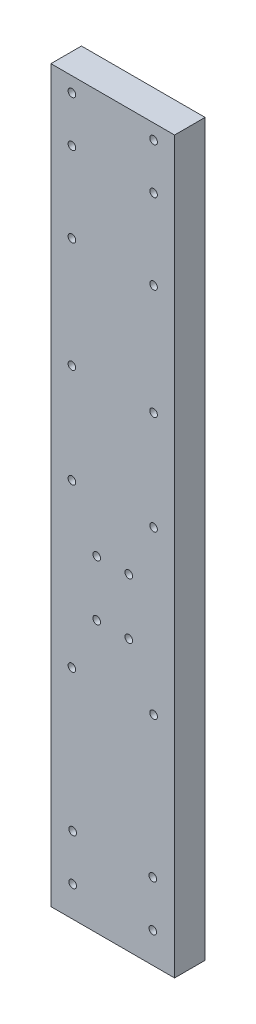
from build123d import *

# Parameters (mm, degrees)
SKETCH3_W           = 16.2
SKETCH3_H           = 95.66
SKETCH3_R           = 0.5
BOSS_EXTRUDE3_DEPTH = 4


with BuildPart() as part:
    # Sketch3 → Boss-Extrude3 (new body)
    with BuildSketch(Plane.XY):
        with Locations((8.1, 47.676448831)):
            Rectangle(SKETCH3_W, SKETCH3_H)
        with Locations((6, 35.346448831)):
            Circle(SKETCH3_R, mode=Mode.SUBTRACT)
        with Locations((10.2, 35.346448831)):
            Circle(SKETCH3_R, mode=Mode.SUBTRACT)
        with Locations((2.75, 87.561448831)):
            Circle(SKETCH3_R, mode=Mode.SUBTRACT)
        with Locations((10.2, 42.666448831)):
            Circle(SKETCH3_R, mode=Mode.SUBTRACT)
        with Locations((13.45, 49.606448831)):
            Circle(SKETCH3_R, mode=Mode.SUBTRACT)
        with Locations(Location((2.75, 93.561448831, 0), (0, 0, 180))):
            Circle(SKETCH3_R, mode=Mode.SUBTRACT)
        with Locations((13.45, 87.561448831)):
            Circle(SKETCH3_R, mode=Mode.SUBTRACT)
        with Locations((2.75, 62.606448831)):
            Circle(SKETCH3_R, mode=Mode.SUBTRACT)
        with Locations((2.85, 9.846448831)):
            Circle(SKETCH3_R, mode=Mode.SUBTRACT)
        with Locations(Location((13.35, 9.846448831, 0), (0, 0, 180))):
            Circle(SKETCH3_R, mode=Mode.SUBTRACT)
        with Locations(Location((13.35, 3.846448831, 0), (0, 0, 180))):
            Circle(SKETCH3_R, mode=Mode.SUBTRACT)
        with Locations((2.85, 3.846448831)):
            Circle(SKETCH3_R, mode=Mode.SUBTRACT)
        with Locations((13.45, 62.606448831)):
            Circle(SKETCH3_R, mode=Mode.SUBTRACT)
        with Locations((2.75, 77.061448831)):
            Circle(SKETCH3_R, mode=Mode.SUBTRACT)
        with Locations((13.45, 28.346448831)):
            Circle(SKETCH3_R, mode=Mode.SUBTRACT)
        with Locations((13.45, 77.061448831)):
            Circle(SKETCH3_R, mode=Mode.SUBTRACT)
        with Locations(Location((13.45, 93.561448831, 0), (0, 0, 180))):
            Circle(SKETCH3_R, mode=Mode.SUBTRACT)
        with Locations((2.75, 28.346448831)):
            Circle(SKETCH3_R, mode=Mode.SUBTRACT)
        with Locations((6, 42.606448831)):
            Circle(SKETCH3_R, mode=Mode.SUBTRACT)
        with Locations((2.75, 49.606448831)):
            Circle(SKETCH3_R, mode=Mode.SUBTRACT)
    extrude(amount=BOSS_EXTRUDE3_DEPTH)


solid = part.part
